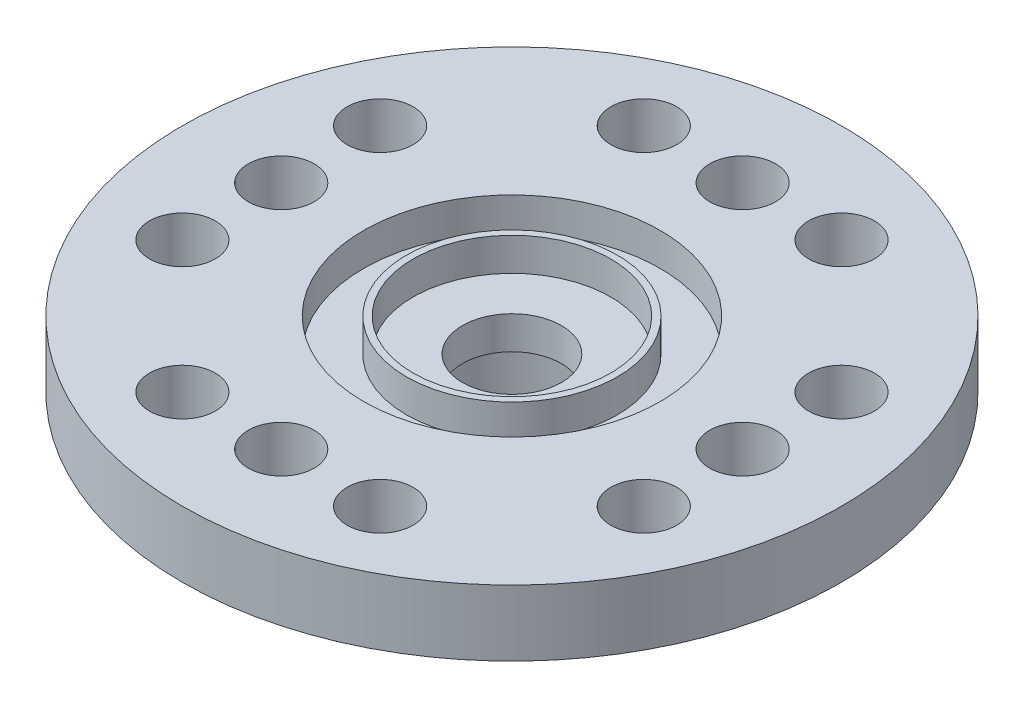
from build123d import *

# Parameters (mm, degrees)
SKETCH1_R           = 4
SKETCH1_R_2         = 3
BOSS_EXTRUDE1_DEPTH = 3
SKETCH2_R           = 10
BOSS_EXTRUDE2_DEPTH = 2
CUT_EXTRUDE1_REACH  = 17
SKETCH3_R           = 1
SKETCH3_R_2         = 1.5
SKETCH4_R           = 4.5
SKETCH4_R_2         = 3.2
SKETCH4_R_3         = 3
SKETCH4_R_4         = 1.5
CUT_EXTRUDE2_DEPTH  = 1


with BuildPart() as part:
    # Sketch1 → Boss-Extrude1 (new body)
    with BuildSketch(Plane(origin=(0, 0, 0), x_dir=(1, 0, 0), z_dir=(0, 1, 0))):
        with Locations(Location((0, 0, 0), (0, 0, 270))):
            Circle(SKETCH1_R)
        with Locations(Location((0, 0, 0), (0, 0, 270))):
            Circle(SKETCH1_R_2, mode=Mode.SUBTRACT)
    extrude(amount=BOSS_EXTRUDE1_DEPTH)

    # Sketch2 → Boss-Extrude2 (add)
    with BuildSketch(Plane(origin=(0, 3, 0), x_dir=(1, 0, 0), z_dir=(0, 1, 0))):
        with Locations(Location((0, 0, 0), (0, 0, 270))):
            Circle(SKETCH2_R)
    extrude(amount=BOSS_EXTRUDE2_DEPTH)

    # Sketch3 → Cut-Extrude1 (cut, up to next)
    with BuildSketch(Plane(origin=(0, 5, 0), x_dir=(1, 0, 0), z_dir=(0, 1, 0)), mode=Mode.PRIVATE) as cut_extrude1_sk1:
        with Locations(Location((0, 7, 0), (0, 0, 270))):
            Circle(SKETCH3_R)
    cut_extrude1_tool1 = extrude(cut_extrude1_sk1.sketch, amount=-CUT_EXTRUDE1_REACH, mode=Mode.PRIVATE) & part.part
    # Sketch3 → Cut-Extrude1 (cut, up to next)
    with BuildSketch(Plane(origin=(0, 5, 0), x_dir=(1, 0, 0), z_dir=(0, 1, 0)), mode=Mode.PRIVATE) as cut_extrude1_sk2:
        with Locations(Location((3, 7, 0), (0, 0, 270))):
            Circle(SKETCH3_R)
    cut_extrude1_tool2 = extrude(cut_extrude1_sk2.sketch, amount=-CUT_EXTRUDE1_REACH, mode=Mode.PRIVATE) & part.part
    # Sketch3 → Cut-Extrude1 (cut, up to next)
    with BuildSketch(Plane(origin=(0, 5, 0), x_dir=(1, 0, 0), z_dir=(0, 1, 0)), mode=Mode.PRIVATE) as cut_extrude1_sk3:
        with Locations(Location((-3, 7, 0), (0, 0, 270))):
            Circle(SKETCH3_R)
    cut_extrude1_tool3 = extrude(cut_extrude1_sk3.sketch, amount=-CUT_EXTRUDE1_REACH, mode=Mode.PRIVATE) & part.part
    # Sketch3 → Cut-Extrude1 (cut, up to next)
    with BuildSketch(Plane(origin=(0, 5, 0), x_dir=(1, 0, 0), z_dir=(0, 1, 0)), mode=Mode.PRIVATE) as cut_extrude1_sk4:
        with Locations(Location((7, 3, 0), (0, 0, 270))):
            Circle(SKETCH3_R)
    cut_extrude1_tool4 = extrude(cut_extrude1_sk4.sketch, amount=-CUT_EXTRUDE1_REACH, mode=Mode.PRIVATE) & part.part
    # Sketch3 → Cut-Extrude1 (cut, up to next)
    with BuildSketch(Plane(origin=(0, 5, 0), x_dir=(1, 0, 0), z_dir=(0, 1, 0)), mode=Mode.PRIVATE) as cut_extrude1_sk5:
        with Locations(Location((7, 0, 0), (0, 0, 270))):
            Circle(SKETCH3_R)
    cut_extrude1_tool5 = extrude(cut_extrude1_sk5.sketch, amount=-CUT_EXTRUDE1_REACH, mode=Mode.PRIVATE) & part.part
    # Sketch3 → Cut-Extrude1 (cut, up to next)
    with BuildSketch(Plane(origin=(0, 5, 0), x_dir=(1, 0, 0), z_dir=(0, 1, 0)), mode=Mode.PRIVATE) as cut_extrude1_sk6:
        with Locations(Location((7, -3, 0), (0, 0, 270))):
            Circle(SKETCH3_R)
    cut_extrude1_tool6 = extrude(cut_extrude1_sk6.sketch, amount=-CUT_EXTRUDE1_REACH, mode=Mode.PRIVATE) & part.part
    # Sketch3 → Cut-Extrude1 (cut, up to next)
    with BuildSketch(Plane(origin=(0, 5, 0), x_dir=(1, 0, 0), z_dir=(0, 1, 0)), mode=Mode.PRIVATE) as cut_extrude1_sk7:
        with Locations(Location((3, -7, 0), (0, 0, 270))):
            Circle(SKETCH3_R)
    cut_extrude1_tool7 = extrude(cut_extrude1_sk7.sketch, amount=-CUT_EXTRUDE1_REACH, mode=Mode.PRIVATE) & part.part
    # Sketch3 → Cut-Extrude1 (cut, up to next)
    with BuildSketch(Plane(origin=(0, 5, 0), x_dir=(1, 0, 0), z_dir=(0, 1, 0)), mode=Mode.PRIVATE) as cut_extrude1_sk8:
        with Locations(Location((0, -7, 0), (0, 0, 270))):
            Circle(SKETCH3_R)
    cut_extrude1_tool8 = extrude(cut_extrude1_sk8.sketch, amount=-CUT_EXTRUDE1_REACH, mode=Mode.PRIVATE) & part.part
    # Sketch3 → Cut-Extrude1 (cut, up to next)
    with BuildSketch(Plane(origin=(0, 5, 0), x_dir=(1, 0, 0), z_dir=(0, 1, 0)), mode=Mode.PRIVATE) as cut_extrude1_sk9:
        with Locations(Location((-3, -7, 0), (0, 0, 270))):
            Circle(SKETCH3_R)
    cut_extrude1_tool9 = extrude(cut_extrude1_sk9.sketch, amount=-CUT_EXTRUDE1_REACH, mode=Mode.PRIVATE) & part.part
    # Sketch3 → Cut-Extrude1 (cut, up to next)
    with BuildSketch(Plane(origin=(0, 5, 0), x_dir=(1, 0, 0), z_dir=(0, 1, 0)), mode=Mode.PRIVATE) as cut_extrude1_sk10:
        with Locations(Location((-7, -3, 0), (0, 0, 270))):
            Circle(SKETCH3_R)
    cut_extrude1_tool10 = extrude(cut_extrude1_sk10.sketch, amount=-CUT_EXTRUDE1_REACH, mode=Mode.PRIVATE) & part.part
    # Sketch3 → Cut-Extrude1 (cut, up to next)
    with BuildSketch(Plane(origin=(0, 5, 0), x_dir=(1, 0, 0), z_dir=(0, 1, 0)), mode=Mode.PRIVATE) as cut_extrude1_sk11:
        with Locations(Location((-7, 0, 0), (0, 0, 270))):
            Circle(SKETCH3_R)
    cut_extrude1_tool11 = extrude(cut_extrude1_sk11.sketch, amount=-CUT_EXTRUDE1_REACH, mode=Mode.PRIVATE) & part.part
    # Sketch3 → Cut-Extrude1 (cut, up to next)
    with BuildSketch(Plane(origin=(0, 5, 0), x_dir=(1, 0, 0), z_dir=(0, 1, 0)), mode=Mode.PRIVATE) as cut_extrude1_sk12:
        with Locations(Location((-7, 3, 0), (0, 0, 270))):
            Circle(SKETCH3_R)
    cut_extrude1_tool12 = extrude(cut_extrude1_sk12.sketch, amount=-CUT_EXTRUDE1_REACH, mode=Mode.PRIVATE) & part.part
    # Sketch3 → Cut-Extrude1 (cut, up to next)
    with BuildSketch(Plane(origin=(0, 5, 0), x_dir=(1, 0, 0), z_dir=(0, 1, 0)), mode=Mode.PRIVATE) as cut_extrude1_sk13:
        with Locations(Location((0, 0, 0), (0, 0, 270))):
            Circle(SKETCH3_R_2)
    cut_extrude1_tool13 = extrude(cut_extrude1_sk13.sketch, amount=-CUT_EXTRUDE1_REACH, mode=Mode.PRIVATE) & part.part
    add(cut_extrude1_tool1.solids().sort_by_distance((0, 5, -7))[0], mode=Mode.SUBTRACT)
    add(cut_extrude1_tool2.solids().sort_by_distance((3, 5, -7))[0], mode=Mode.SUBTRACT)
    add(cut_extrude1_tool3.solids().sort_by_distance((-3, 5, -7))[0], mode=Mode.SUBTRACT)
    add(cut_extrude1_tool4.solids().sort_by_distance((7, 5, -3))[0], mode=Mode.SUBTRACT)
    add(cut_extrude1_tool5.solids().sort_by_distance((7, 5, 0))[0], mode=Mode.SUBTRACT)
    add(cut_extrude1_tool6.solids().sort_by_distance((7, 5, 3))[0], mode=Mode.SUBTRACT)
    add(cut_extrude1_tool7.solids().sort_by_distance((3, 5, 7))[0], mode=Mode.SUBTRACT)
    add(cut_extrude1_tool8.solids().sort_by_distance((0, 5, 7))[0], mode=Mode.SUBTRACT)
    add(cut_extrude1_tool9.solids().sort_by_distance((-3, 5, 7))[0], mode=Mode.SUBTRACT)
    add(cut_extrude1_tool10.solids().sort_by_distance((-7, 5, 3))[0], mode=Mode.SUBTRACT)
    add(cut_extrude1_tool11.solids().sort_by_distance((-7, 5, 0))[0], mode=Mode.SUBTRACT)
    add(cut_extrude1_tool12.solids().sort_by_distance((-7, 5, -3))[0], mode=Mode.SUBTRACT)
    add(cut_extrude1_tool13.solids().sort_by_distance((0, 5, 0))[0], mode=Mode.SUBTRACT)

    # Sketch4 → Cut-Extrude2 (cut)
    # profile 1 of 2: a face of its own
    with BuildSketch(Plane(origin=(0, 5, 0), x_dir=(1, 0, 0), z_dir=(0, 1, 0))):
        with Locations(Location((0, 0, 0), (0, 0, 270))):
            Circle(SKETCH4_R)
        with Locations(Location((0, 0, 0), (0, 0, 270))):
            Circle(SKETCH4_R_2, mode=Mode.SUBTRACT)
    # profile 2 of 2: a face of its own
    with BuildSketch(Plane(origin=(0, 5, 0), x_dir=(1, 0, 0), z_dir=(0, 1, 0))):
        with Locations(Location((0, 0, 0), (0, 0, 270))):
            Circle(SKETCH4_R_3)
        with Locations(Location((0, 0, 0), (0, 0, 270))):
            Circle(SKETCH4_R_4, mode=Mode.SUBTRACT)
    extrude(amount=-CUT_EXTRUDE2_DEPTH, mode=Mode.SUBTRACT)


solid = part.part
